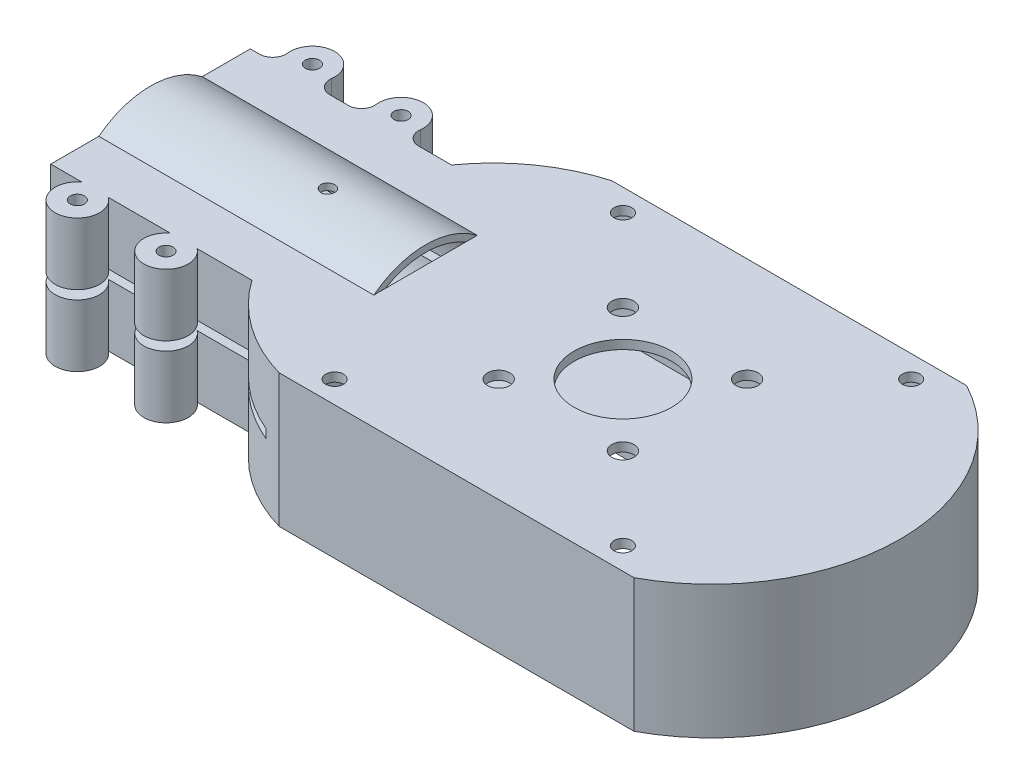
from build123d import *

# Parameters (mm, degrees)
SKETCH_1_W           = 80
SKETCH_1_H           = 75
EXTRUDE_1_DEPTH      = 15
EXTRUDE_2_REACH      = 175.759
EXTRUDE_2_END_RADIUS = 39
SKETCH_2_W           = 45
SKETCH_2_H           = 30
SKETCH_3_R           = 19
EXTRUDE_3_DEPTH      = 62
SKETCH_4_R           = 17.5
CUT_EXTRUDE_1_DEPTH  = 62
SKETCH_6_R           = 5
EXTRUDE_4_DEPTH      = 30
FILLET_1_R           = 3
SKETCH_7_R           = 1.6
CUT_EXTRUDE_3_DEPTH  = 62
SKETCH_5_W           = 78.155385632
SKETCH_5_H           = 2
CUT_EXTRUDE_4_DEPTH  = 62
SKETCH_8_R           = 11
CUT_EXTRUDE_5_DEPTH  = 62
SKETCH_9_R           = 2.5
CUT_EXTRUDE_6_DEPTH  = 118.917343932
SKETCH_10_R          = 2
CUT_EXTRUDE_7_DEPTH  = 118.917343932
SKETCH_11_R          = 2
SKETCH_11_R_2        = 2.5
SKETCH_11_R_3        = 11
CUT_EXTRUDE_8_DEPTH  = 28
SKETCH_12_W          = 72
SKETCH_12_H          = 29.5
EXTRUDE_6_DEPTH      = 2
SKETCH_13_R          = 1.5
CUT_EXTRUDE_9_DEPTH  = 2
SKETCH_14_R          = 1.55
CUT_EXTRUDE_10_DEPTH = 250


with BuildPart() as part:
    # 草图1 → 凸台-拉伸1 (new, symmetric)
    with BuildSketch(Plane(origin=(0, 0, 0), x_dir=(1, 0, 0), z_dir=(0, 1, 0))):
        with BuildLine():
            Line((-40, -37.5), (-40, 37.5))
            ThreePointArc((-40, 37.5), (-68.287857357, 0), (-40, -37.5))
        make_face()
        Rectangle(SKETCH_1_W, SKETCH_1_H)
        with BuildLine():
            Line((40, -37.5), (40, 37.5))
            ThreePointArc((40, 37.5), (62.5, 0), (40, -37.5))
        make_face()
    extrude(amount=EXTRUDE_1_DEPTH, both=True)

    # 凸台-拉伸2: up to this cylinder (the profile starts outside it)
    extrude_2_end = Plane(origin=(-29.287857357, 0, 0), z_dir=(0, -1, 0)) * Cylinder(EXTRUDE_2_END_RADIUS, 430.518, mode=Mode.PRIVATE)
    # 草图2 → 凸台-拉伸2 (add, up to the surface)
    with BuildSketch(Plane(origin=(-106.5, 0, 0), x_dir=(0, 0, -1), z_dir=(1, 0, 0)), mode=Mode.PRIVATE) as extrude_2_sk1:
        Rectangle(SKETCH_2_W, SKETCH_2_H)
    extrude_2_tool1 = extrude(extrude_2_sk1.sketch, amount=EXTRUDE_2_REACH, mode=Mode.PRIVATE) - extrude_2_end
    add(extrude_2_tool1.solids().sort_by_distance((-106.5, 0, 0))[0])

    # 草图3 → 凸台-拉伸3 (add)
    with BuildSketch(Plane.ZY.offset(106.5)):
        Circle(SKETCH_3_R)
    extrude(amount=-EXTRUDE_3_DEPTH)

    # 草图4 → 切除-拉伸1 (cut)
    with BuildSketch(Plane.ZY.offset(106.5)):
        Circle(SKETCH_4_R)
    extrude(amount=-CUT_EXTRUDE_1_DEPTH, mode=Mode.SUBTRACT)

    # 草图6 → 凸台-拉伸4 (add)
    with BuildSketch(Plane(origin=(0, 15, 0), x_dir=(1, 0, 0), z_dir=(0, 1, 0))):
        with Locations((-96.5, 26.5)):
            Circle(SKETCH_6_R)
        with Locations((-76.5, 26.5)):
            Circle(SKETCH_6_R)
    extrude_4 = extrude(amount=-EXTRUDE_4_DEPTH)

    # 圆角1
    fillet_1_edges = [part.edges().sort_by_distance(p)[0] for p in [
        (-99.5, 0, -22.5),
        (-93.5, 0, -22.5),
        (-73.5, 0, -22.5),
        (-79.5, 0, -22.5),
    ]]
    fillet(fillet_1_edges, radius=FILLET_1_R)

    # 镜向3: 凸台-拉伸4 across plane
    add(extrude_4.mirror(Plane.XY))

    # 草图7 → 切除-拉伸3 (cut)
    with BuildSketch(Plane(origin=(0, 15, 0), x_dir=(1, 0, 0), z_dir=(0, 1, 0))):
        with Locations(Location((-96.5, 26.5, 0), (0, 0, 270))):
            Circle(SKETCH_7_R)
        with Locations(Location((-76.5, 26.5, 0), (0, 0, 270))):
            Circle(SKETCH_7_R)
        with Locations(Location((-76.5, -26.5, 0), (0, 0, 270))):
            Circle(SKETCH_7_R)
        with Locations(Location((-96.5, -26.5, 0), (0, 0, 270))):
            Circle(SKETCH_7_R)
    extrude(amount=-CUT_EXTRUDE_3_DEPTH, mode=Mode.SUBTRACT)

    # 草图5 → 切除-拉伸4 (cut)
    with BuildSketch(Plane.ZY.offset(106.5)):
        Rectangle(SKETCH_5_W, SKETCH_5_H)
    extrude(amount=-CUT_EXTRUDE_4_DEPTH, mode=Mode.SUBTRACT)

    # 草图8 → 切除-拉伸5 (cut)
    with BuildSketch(Plane.XZ.offset(15)):
        with Locations(Location((0, 0, 0), (0, 0, 270))):
            Circle(SKETCH_8_R)
    extrude(amount=-CUT_EXTRUDE_5_DEPTH, mode=Mode.SUBTRACT)

    # 草图9 → 切除-拉伸6 (cut, through all)
    with BuildSketch(Plane.XZ.offset(15)):
        with Locations(Location((14, 14, 0), (0, 0, 270))):
            Circle(SKETCH_9_R)
        with Locations(Location((14, -14, 0), (0, 0, 270))):
            Circle(SKETCH_9_R)
        with Locations(Location((-14, -14, 0), (0, 0, 270))):
            Circle(SKETCH_9_R)
        with Locations(Location((-14, 14, 0), (0, 0, 270))):
            Circle(SKETCH_9_R)
    extrude(amount=-CUT_EXTRUDE_6_DEPTH, mode=Mode.SUBTRACT)

    # 草图10 → 切除-拉伸7 (cut, through all)
    with BuildSketch(Plane(origin=(0, 15, 0), x_dir=(1, 0, 0), z_dir=(0, 1, 0))):
        with Locations(Location((32.5, 32.5, 0), (0, 0, 270))):
            Circle(SKETCH_10_R)
        with Locations(Location((-32.5, 32.5, 0), (0, 0, 270))):
            Circle(SKETCH_10_R)
        with Locations(Location((-32.5, -32.5, 0), (0, 0, 270))):
            Circle(SKETCH_10_R)
        with Locations(Location((32.5, -32.5, 0), (0, 0, 270))):
            Circle(SKETCH_10_R)
    extrude(amount=-CUT_EXTRUDE_7_DEPTH, mode=Mode.SUBTRACT)

    # 草图11 → 切除-拉伸8 (cut)
    with BuildSketch(Plane.XZ.offset(15)):
        with BuildLine():
            Line((-44.5, 9.013878189), (-44.5, 0))
            Line((-44.5, 0), (-44.5, -9.013878189))
            Line((-44.5, -9.013878189), (-44.5, -11.66190379))
            Line((-44.5, -11.66190379), (-44.5, -33.728188748))
            ThreePointArc((-44.5, -33.728188748), (-42.138664615, -34.696638927), (-39.716184164, -35.5))
            Line((-39.716184164, -35.5), (39.49358869, -35.5))
            ThreePointArc((39.49358869, -35.5), (60.5, 0), (39.49358869, 35.5))
            Line((39.49358869, 35.5), (-39.716184164, 35.5))
            ThreePointArc((-39.716184164, 35.5), (-42.138664615, 34.696638927), (-44.5, 33.728188748))
            Line((-44.5, 33.728188748), (-44.5, 11.66190379))
            Line((-44.5, 11.66190379), (-44.5, 9.013878189))
        make_face()
        with Locations(Location((-32.5, -32.5, 0), (0, 0, 90))):
            Circle(SKETCH_11_R, mode=Mode.SUBTRACT)
        with Locations(Location((-14, -14, 0), (0, 0, 270))):
            Circle(SKETCH_11_R_2, mode=Mode.SUBTRACT)
        with Locations(Location((32.5, -32.5, 0), (0, 0, 90))):
            Circle(SKETCH_11_R, mode=Mode.SUBTRACT)
        with Locations(Location((14, -14, 0), (0, 0, 270))):
            Circle(SKETCH_11_R_2, mode=Mode.SUBTRACT)
        with Locations(Location((0, 0, 0), (0, 0, 270))):
            Circle(SKETCH_11_R_3, mode=Mode.SUBTRACT)
        with Locations(Location((-14, 14, 0), (0, 0, 270))):
            Circle(SKETCH_11_R_2, mode=Mode.SUBTRACT)
        with Locations(Location((-32.5, 32.5, 0), (0, 0, 90))):
            Circle(SKETCH_11_R, mode=Mode.SUBTRACT)
        with Locations(Location((14, 14, 0), (0, 0, 270))):
            Circle(SKETCH_11_R_2, mode=Mode.SUBTRACT)
        with Locations(Location((32.5, 32.5, 0), (0, 0, 90))):
            Circle(SKETCH_11_R, mode=Mode.SUBTRACT)
    extrude(amount=-CUT_EXTRUDE_8_DEPTH, mode=Mode.SUBTRACT)

    # 草图12 → 凸台-拉伸6 (add)
    with BuildSketch(Plane.XZ.offset(15)):
        with BuildLine():
            Line((-44.5, 11.66190379), (-44.5, -11.66190379))
            Line((-44.5, -11.66190379), (-44.5, -33.728188748))
            ThreePointArc((-44.5, -33.728188748), (-42.138664615, -34.696638927), (-39.716184164, -35.5))
            Line((-39.716184164, -35.5), (39.49358869, -35.5))
            ThreePointArc((39.49358869, -35.5), (60.5, 0), (39.49358869, 35.5))
            Line((39.49358869, 35.5), (-39.716184164, 35.5))
            ThreePointArc((-39.716184164, 35.5), (-42.138664615, 34.696638927), (-44.5, 33.728188748))
            Line((-44.5, 33.728188748), (-44.5, 11.66190379))
        make_face()
        Rectangle(SKETCH_12_W, SKETCH_12_H, mode=Mode.SUBTRACT)
    extrude(amount=-EXTRUDE_6_DEPTH)

    # 草图13 → 切除-拉伸9 (cut)
    with BuildSketch(Plane.XZ.offset(15)):
        with Locations(Location((-44.75, 19, 0), (0, 0, 270))):
            Circle(SKETCH_13_R)
        with Locations(Location((0, 19, 0), (0, 0, 270))):
            Circle(SKETCH_13_R)
        with Locations(Location((44.75, 19, 0), (0, 0, 270))):
            Circle(SKETCH_13_R)
        with Locations(Location((44.75, -19, 0), (0, 0, 270))):
            Circle(SKETCH_13_R)
        with Locations(Location((0, -19, 0), (0, 0, 270))):
            Circle(SKETCH_13_R)
        with Locations(Location((-44.75, -19, 0), (0, 0, 270))):
            Circle(SKETCH_13_R)
    extrude(amount=-CUT_EXTRUDE_9_DEPTH, mode=Mode.SUBTRACT)

    # 草图14 → 切除-拉伸10 (cut, symmetric)
    with BuildSketch(Plane(origin=(0, 0, 0), x_dir=(1, 0, 0), z_dir=(0, 1, 0))):
        with Locations(Location((-66.5, 0, 0), (0, 0, 270))):
            Circle(SKETCH_14_R)
    extrude(amount=CUT_EXTRUDE_10_DEPTH, both=True, mode=Mode.SUBTRACT)


solid = part.part
